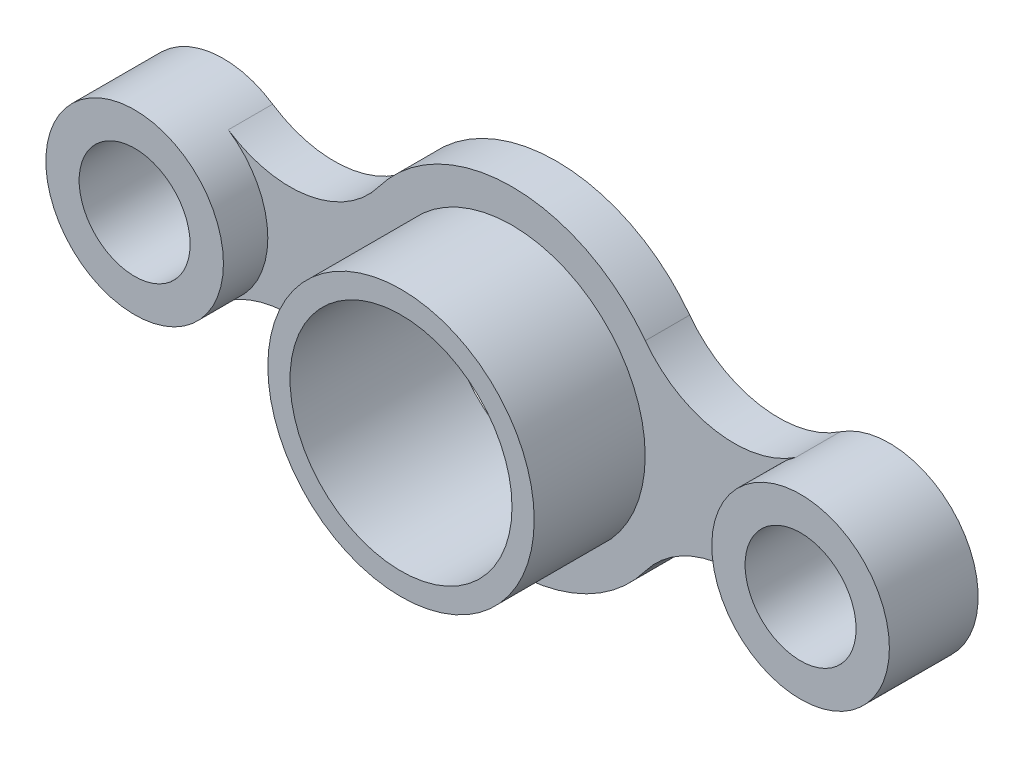
from build123d import *

# Parameters (mm, degrees)
SKETCH1_R           = 60
BOSS_EXTRUDE4_DEPTH = 20
SKETCH1_5_R         = 25
BOSS_EXTRUDE5_DEPTH = 40
SKETCH1_6_R         = 25
BOSS_EXTRUDE6_DEPTH = 40
SKETCH1_7_R         = 60
SKETCH1_7_R_2       = 50
BOSS_EXTRUDE7_DEPTH = 70


with BuildPart() as part:
    # Sketch1 → Boss-Extrude4 (new body)
    with BuildSketch(Plane.XY):
        with BuildLine():
            ThreePointArc((-60.05, -44.933256058), (0, -75), (60.05, -44.933256058))
            ThreePointArc((60.05, -44.933256058), (91.612158535, -25.611592996), (127.814814815, -33.283893377))
            ThreePointArc((127.814814815, -33.283893377), (110, 0), (127.814814815, 33.283893377))
            ThreePointArc((127.814814815, 33.283893377), (91.612158535, 25.611592996), (60.05, 44.933256058))
            ThreePointArc((60.05, 44.933256058), (0, 75), (-60.05, 44.933256058))
            ThreePointArc((-60.05, 44.933256058), (-91.612158535, 25.611592996), (-127.814814815, 33.283893377))
            ThreePointArc((-127.814814815, 33.283893377), (-110, 0), (-127.814814815, -33.283893377))
            ThreePointArc((-127.814814815, -33.283893377), (-91.612158535, -25.611592996), (-60.05, -44.933256058))
        make_face()
        Circle(SKETCH1_R, mode=Mode.SUBTRACT)
    extrude(amount=BOSS_EXTRUDE4_DEPTH)

    # Sketch1<5> → Boss-Extrude5 (add)
    with BuildSketch(Plane.XY):
        with BuildLine():
            ThreePointArc((-110, 0), (-114.733816428, 18.875812467), (-127.814814815, 33.283893377))
            ThreePointArc((-127.814814815, 33.283893377), (-190, 0), (-127.814814815, -33.283893377))
            ThreePointArc((-127.814814815, -33.283893377), (-114.733816428, -18.875812467), (-110, 0))
        make_face()
        with Locations((-150, 0)):
            Circle(SKETCH1_5_R, mode=Mode.SUBTRACT)
    extrude(amount=BOSS_EXTRUDE5_DEPTH)

    # Sketch1<6> → Boss-Extrude6 (add)
    with BuildSketch(Plane.XY):
        with BuildLine():
            ThreePointArc((190, 0), (168.875812467, 35.266183572), (127.814814815, 33.283893377))
            ThreePointArc((127.814814815, 33.283893377), (110, 0), (127.814814815, -33.283893377))
            ThreePointArc((127.814814815, -33.283893377), (168.875812467, -35.266183572), (190, 0))
        make_face()
        with Locations((150, 0)):
            Circle(SKETCH1_6_R, mode=Mode.SUBTRACT)
    extrude(amount=BOSS_EXTRUDE6_DEPTH)

    # Sketch1<7> → Boss-Extrude7 (add)
    with BuildSketch(Plane.XY):
        Circle(SKETCH1_7_R)
        Circle(SKETCH1_7_R_2, mode=Mode.SUBTRACT)
    extrude(amount=BOSS_EXTRUDE7_DEPTH)


solid = part.part
